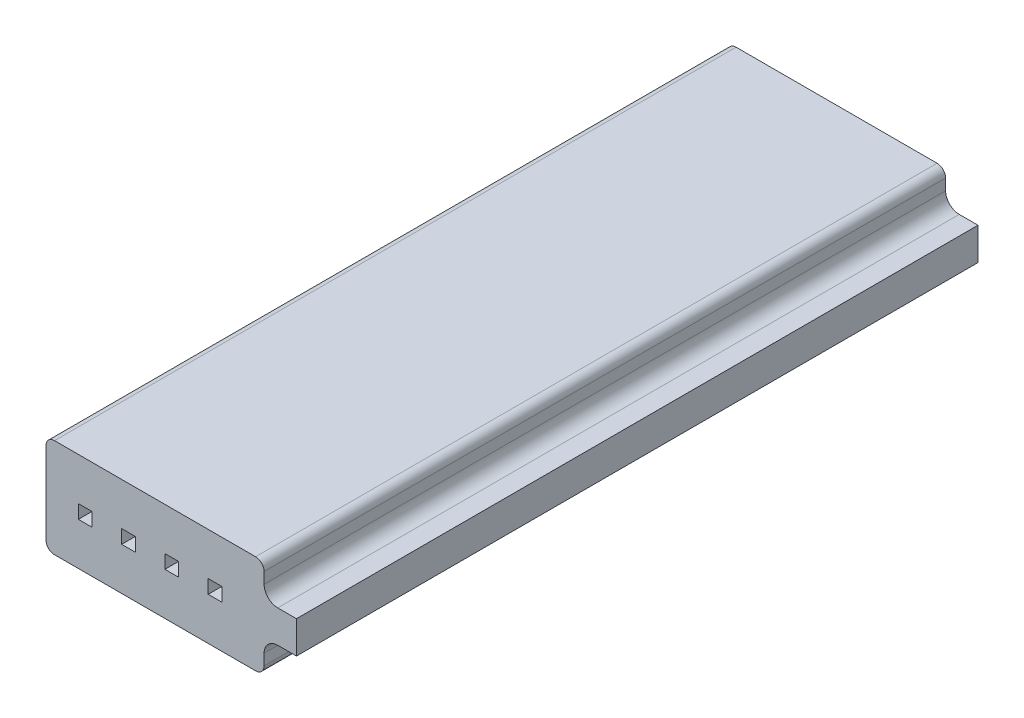
from build123d import *

# Parameters (mm, degrees)
BOSS_EXTRU_1_DEPTH         = 40
ESQUISSE3_W                = 0.8
ESQUISSE3_H                = 0.8
ENL_V_MAT_EXTRU_1_DEPTH    = 41.954853192
R_P_TITION_LIN_AIRE1_COUNT = 4
R_P_TITION_LIN_AIRE1_PITCH = 2.54
CONG_1_R                   = 0.8
CONG_2_R                   = 0.5


with BuildPart() as part:
    # Esquisse1 → Boss.-Extru.1 (new body)
    with BuildSketch(Plane.XY):
        Polygon((6.4, 0.95), (8.3, 0.95), (8.3, -0.95), (6.4, -0.95), (6.4, -2.9), (-6.4, -2.9), (-6.4, 2.9), (6.4, 2.9), align=None)
    extrude(amount=BOSS_EXTRU_1_DEPTH)

    # Esquisse3 → Enlèv. mat.-Extru.1 (cut, through all)
    with BuildSketch(Plane(origin=(0, 0, 0), x_dir=(-1, 0, 0), z_dir=(0, 0, -1))):
        with Locations((4.1, 0)):
            Rectangle(ESQUISSE3_W, ESQUISSE3_H)
    enl_v_mat_extru_1 = extrude(amount=-ENL_V_MAT_EXTRU_1_DEPTH, mode=Mode.SUBTRACT)

    # Répétition linéaire1: Enlèv. mat.-Extru.1 ×4
    with Locations(*[(i * R_P_TITION_LIN_AIRE1_PITCH, 0, 0) for i in range(1, R_P_TITION_LIN_AIRE1_COUNT)]):
        add(enl_v_mat_extru_1, mode=Mode.SUBTRACT)

    # Congé1
    cong_1_edges = [part.edges().sort_by_distance(p)[0] for p in [
        (6.4, 0.95, 20),
        (6.4, -0.95, 20),
    ]]
    fillet(cong_1_edges, radius=CONG_1_R)

    # Congé2
    cong_2_edges = [part.edges().sort_by_distance(p)[0] for p in [
        (6.4, -2.9, 20),
        (-6.4, -2.9, 20),
        (-6.4, 2.9, 20),
        (6.4, 2.9, 20),
    ]]
    fillet(cong_2_edges, radius=CONG_2_R)


solid = part.part
